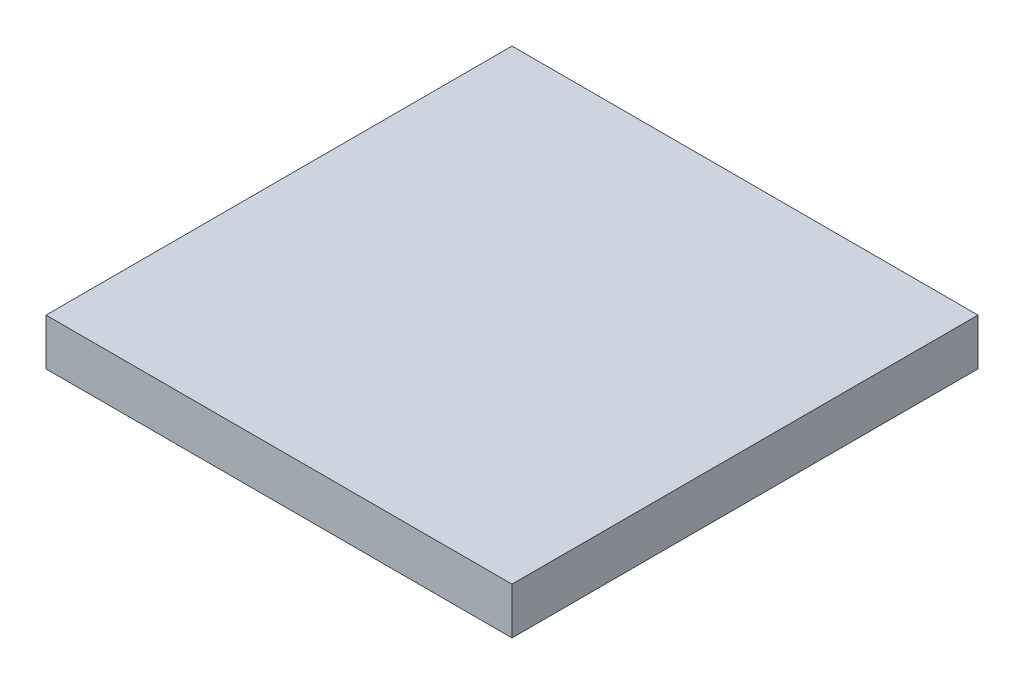
from build123d import *

# Parameters (mm, degrees)
SKETCH1_W           = 30
SKETCH1_H           = 30
BOSS_EXTRUDE1_DEPTH = 3


with BuildPart() as part:
    # Sketch1 → Boss-Extrude1 (new body)
    with BuildSketch(Plane(origin=(0, 0, 0), x_dir=(1, 0, 0), z_dir=(0, 1, 0))):
        Rectangle(SKETCH1_W, SKETCH1_H)
    extrude(amount=BOSS_EXTRUDE1_DEPTH)


solid = part.part
